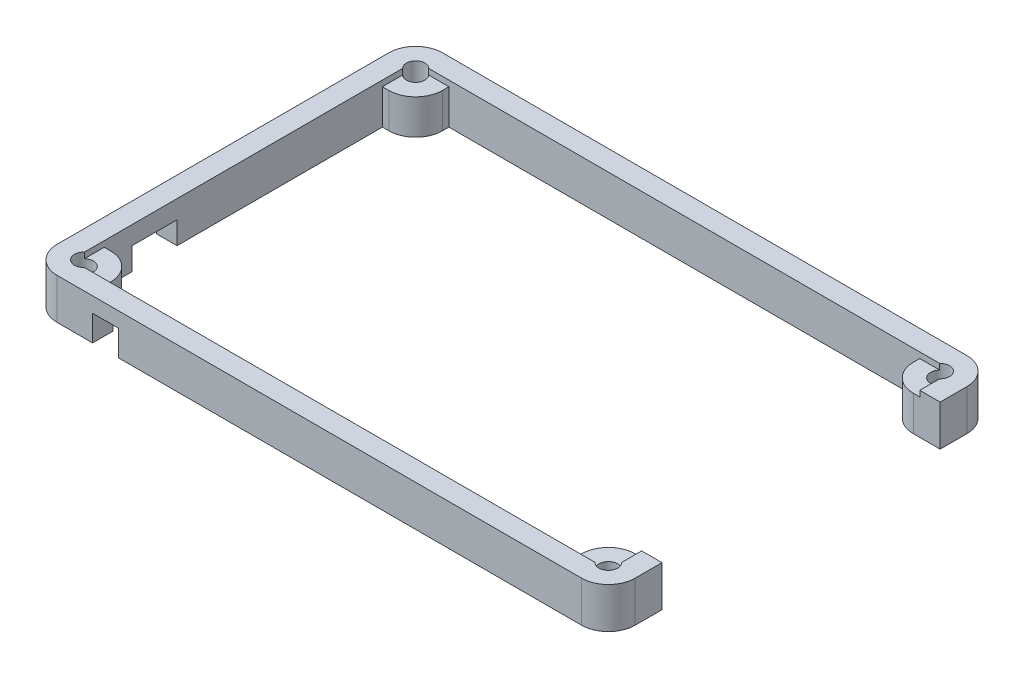
from build123d import *

# Parameters (mm, degrees)
BOSS_EXTRUDE3_DEPTH = 6.35
SKETCH5_W           = 7
SKETCH5_H           = 7
CUT_EXTRUDE3_DEPTH  = 3.175
SKETCH7_R           = 1.4224
SKETCH7_R_2         = 1.4732
CUT_EXTRUDE5_DEPTH  = 6.35
SKETCH8_W           = 3.175
SKETCH8_H           = 43.3
CUT_EXTRUDE6_DEPTH  = 10
SKETCH9_W           = 4
SKETCH9_H           = 4
CUT_EXTRUDE8_DEPTH  = 4
SKETCH10_W          = 5.175
SKETCH10_H          = 5.175
SKETCH10_W_2        = 5.18
CUT_EXTRUDE9_DEPTH  = 0.9


with BuildPart() as part:
    # Sketch2 → Boss-Extrude3 (new body)
    with BuildSketch(Plane(origin=(0, 0, 0), x_dir=(1, 0, 0), z_dir=(0, 1, 0))):
        with BuildLine():
            Line((-45, 25.825), (-45, -25.825))
            ThreePointArc((-45, -25.825), (-43.777170811, -28.777170811), (-40.825, -30))
            Line((-40.825, -30), (40.825, -30))
            ThreePointArc((40.825, -30), (43.777170811, -28.777170811), (45, -25.825))
            Line((45, -25.825), (45, 25.825))
            ThreePointArc((45, 25.825), (43.777170811, 28.777170811), (40.825, 30))
            Line((40.825, 30), (-40.825, 30))
            ThreePointArc((-40.825, 30), (-43.777170811, 28.777170811), (-45, 25.825))
        make_face()
        with BuildLine():
            Line((40.825, 21.65), (41.825, 21.65))
            Line((41.825, 21.65), (41.825, -21.65))
            Line((41.825, -21.65), (40.825, -21.65))
            ThreePointArc((40.825, -21.65), (37.872829189, -22.872829189), (36.65, -25.825))
            Line((36.65, -25.825), (36.65, -26.825))
            Line((36.65, -26.825), (-36.65, -26.825))
            Line((-36.65, -26.825), (-36.65, -25.825))
            ThreePointArc((-36.65, -25.825), (-37.872829189, -22.872829189), (-40.825, -21.65))
            Line((-40.825, -21.65), (-41.825, -21.65))
            Line((-41.825, -21.65), (-41.825, 21.65))
            Line((-41.825, 21.65), (-40.825, 21.65))
            ThreePointArc((-40.825, 21.65), (-37.872829189, 22.872829189), (-36.65, 25.825))
            Line((-36.65, 25.825), (-36.65, 26.825))
            Line((-36.65, 26.825), (36.65, 26.825))
            Line((36.65, 26.825), (36.65, 25.825))
            ThreePointArc((36.65, 25.825), (37.872829189, 22.872829189), (40.825, 21.65))
        make_face(mode=Mode.SUBTRACT)
    extrude(amount=BOSS_EXTRUDE3_DEPTH)

    # Sketch5 → Cut-Extrude3 (cut)
    with BuildSketch(Plane.ZY.offset(45)):
        with Locations((13.825, 0)):
            Rectangle(SKETCH5_W, SKETCH5_H)
    extrude(amount=-CUT_EXTRUDE3_DEPTH, mode=Mode.SUBTRACT)

    # Sketch7 → Cut-Extrude5 (cut)
    with BuildSketch(Plane.XZ):
        with Locations(Location((-40.825, -25.825, 0), (0, 0, 270))):
            Circle(SKETCH7_R)
        with Locations(Location((-40.825, 25.81356336, 0), (0, 0, 270))):
            Circle(SKETCH7_R_2)
        with Locations(Location((40.825, 25.825, 0), (0, 0, 270))):
            Circle(SKETCH7_R_2)
        with Locations(Location((40.825, -25.81487963, 0), (0, 0, 270))):
            Circle(SKETCH7_R_2)
    extrude(amount=-CUT_EXTRUDE5_DEPTH, mode=Mode.SUBTRACT)

    # Sketch8 → Cut-Extrude6 (cut)
    with BuildSketch(Plane(origin=(0, 6.35, 0), x_dir=(1, 0, 0), z_dir=(0, 1, 0))):
        with Locations((43.4125, 0)):
            Rectangle(SKETCH8_W, SKETCH8_H)
    extrude(amount=-CUT_EXTRUDE6_DEPTH, mode=Mode.SUBTRACT)

    # Sketch9 → Cut-Extrude8 (cut)
    with BuildSketch(Plane.XY.offset(30)):
        with Locations((-33.2866, 2)):
            Rectangle(SKETCH9_W, SKETCH9_H)
    extrude(amount=-CUT_EXTRUDE8_DEPTH, mode=Mode.SUBTRACT)

    # Sketch10 → Cut-Extrude9 (cut)
    with BuildSketch(Plane(origin=(0, 6.35, 0), x_dir=(1, 0, 0), z_dir=(0, 1, 0))):
        with Locations((-39.2375, 24.2375)):
            Rectangle(SKETCH10_W, SKETCH10_H)
        with Locations((-39.2375, -24.2375)):
            Rectangle(SKETCH10_W, SKETCH10_H)
        with Locations((39.24, -24.2375)):
            Rectangle(SKETCH10_W_2, SKETCH10_H)
        with Locations((39.24, 24.2375)):
            Rectangle(SKETCH10_W_2, SKETCH10_H)
    extrude(amount=-CUT_EXTRUDE9_DEPTH, mode=Mode.SUBTRACT)


solid = part.part
